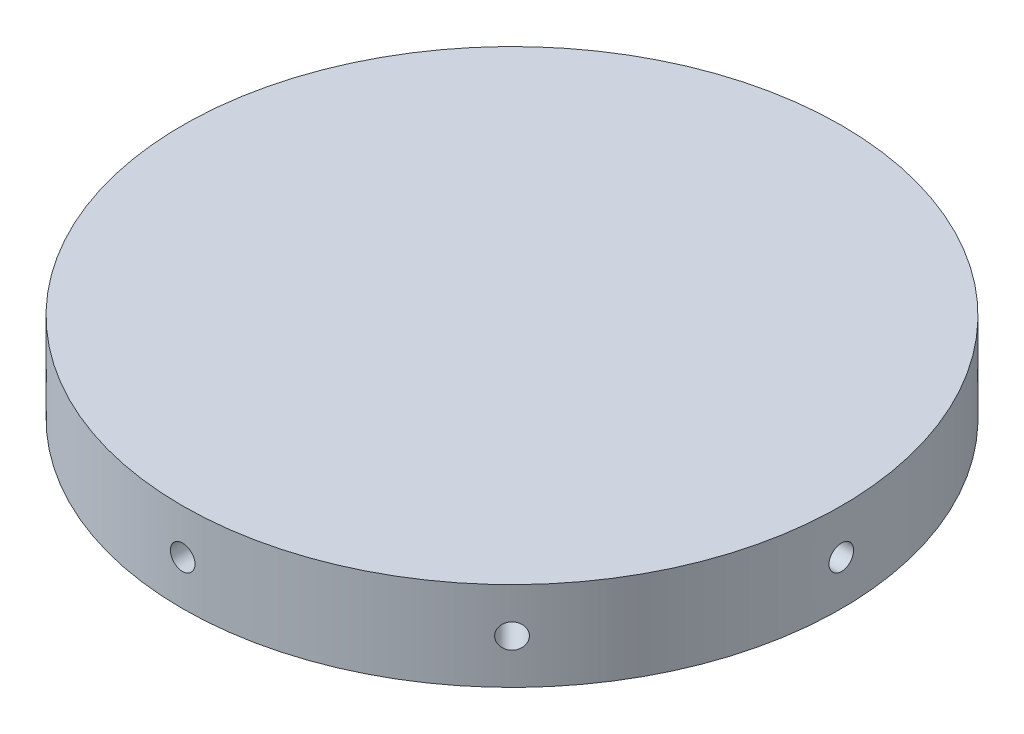
from build123d import *

# Parameters (mm, degrees)
SKETCH1_R           = 46.99
BOSS_EXTRUDE1_DEPTH = 12.7
SKETCH2_R           = 1.7526
CUT_EXTRUDE1_DEPTH  = 19.05
CIRPATTERN1_COUNT   = 8


with BuildPart() as part:
    # Sketch1 → Boss-Extrude1 (new body)
    with BuildSketch(Plane(origin=(0, 0, 0), x_dir=(1, 0, 0), z_dir=(0, 1, 0))):
        with Locations(Location((0, 0, 0), (0, 0, 270))):
            Circle(SKETCH1_R)
    extrude(amount=BOSS_EXTRUDE1_DEPTH)

    # Sketch2 → Cut-Extrude1 (cut)
    with BuildSketch(Plane.XY.offset(46.99)):
        with Locations((0, 6.35)):
            Circle(SKETCH2_R)
    cut_extrude1 = extrude(amount=-CUT_EXTRUDE1_DEPTH, mode=Mode.SUBTRACT)

    # CirPattern1: Cut-Extrude1 ×8 about axis
    cirpattern1_axis = Axis((0, 0, 0), (0, 1, 0))
    for i in range(1, CIRPATTERN1_COUNT):
        add(cut_extrude1.rotate(cirpattern1_axis, i * 360 / CIRPATTERN1_COUNT), mode=Mode.SUBTRACT)


solid = part.part
